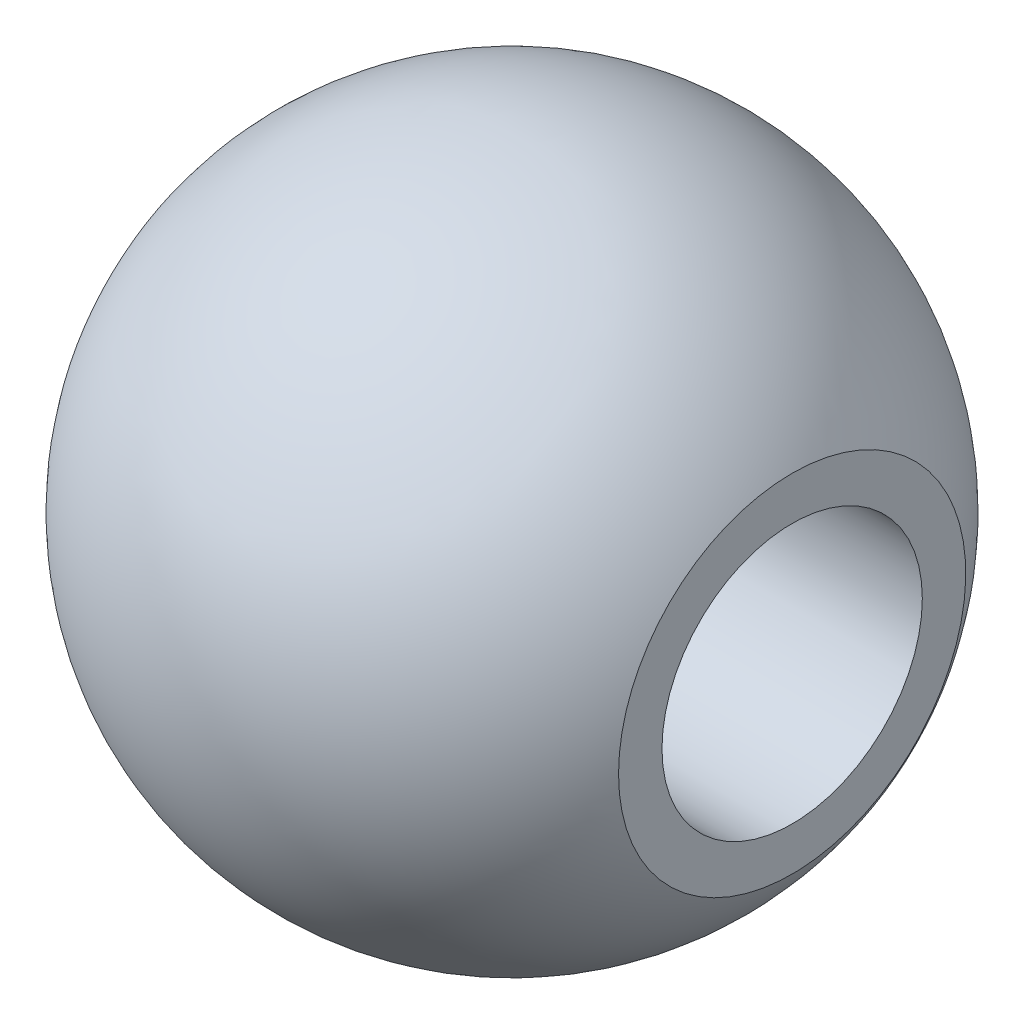
from build123d import *


with BuildPart() as part:
    # Sketch1 → Revolve1 (revolve)
    with BuildSketch(Plane.XY, mode=Mode.PRIVATE) as revolve1_sk:
        with BuildLine():
            Line((46.99, 13.380280266), (46.99, 10.033))
            Line((46.99, 10.033), (13.49375, 10.033))
            ThreePointArc((13.49375, 10.033), (12.7, 10.82675), (11.90625, 10.033))
            Line((11.90625, 10.033), (5.334, 10.033))
            Line((5.334, 10.033), (5.334, 0))
            Line((5.334, 0), (0, 0))
            ThreePointArc((0, 0), (18.44392352, 24.428937758), (46.99, 13.380280266))
        make_face()
    revolve(revolve1_sk.sketch.rotate(Axis((0, 0, 0), (1, 0, 0)), 90), axis=Axis((0, 0, 0), (1, 0, 0)))


solid = part.part
